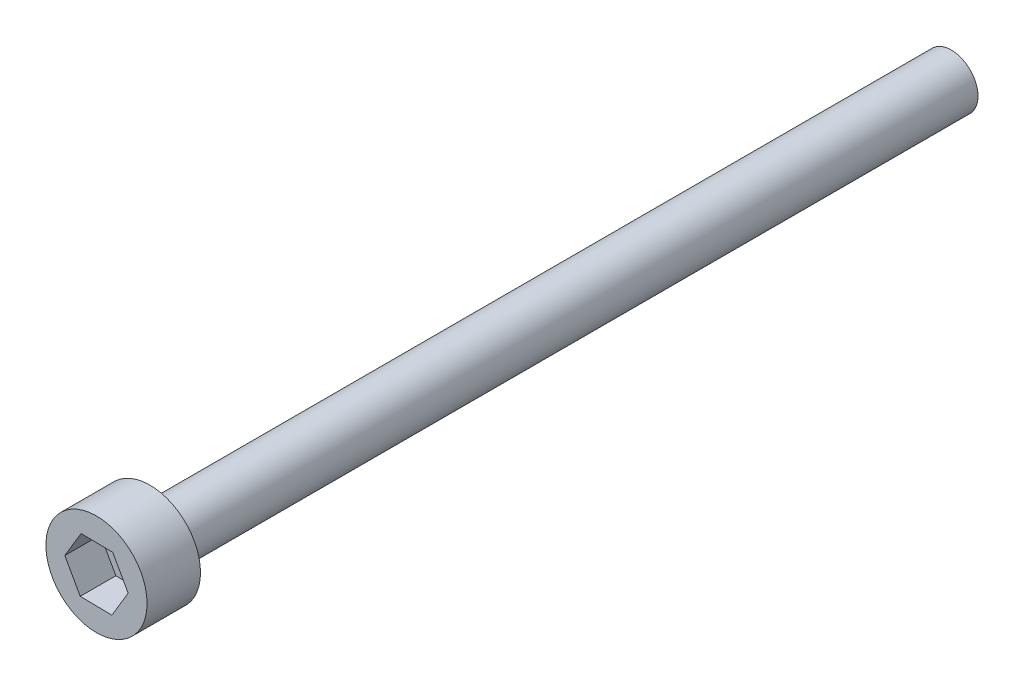
from build123d import *

# Parameters (mm, degrees)
SKETCH_1_R          = 2.84
EXTRUDE_1_DEPTH     = 3
SKETCH_2_R          = 1.5
EXTRUDE_2_DEPTH     = 45
CUT_EXTRUDE_1_DEPTH = 2


with BuildPart() as part:
    # 草图1 → 凸台-拉伸1 (new body)
    with BuildSketch(Plane.XY):
        Circle(SKETCH_1_R)
    extrude(amount=EXTRUDE_1_DEPTH)

    # 草图2 → 凸台-拉伸2 (add)
    with BuildSketch(Plane(origin=(0, 0, 0), x_dir=(-1, 0, 0), z_dir=(0, 0, -1))):
        with Locations(Location((0, 0, 0), (0, 0, 180))):
            Circle(SKETCH_2_R)
    extrude(amount=EXTRUDE_2_DEPTH)

    # 草图3 → 切除-拉伸1 (cut)
    with BuildSketch(Plane.XY.offset(3)):
        Polygon((0.912581429, 1.526213769), (-0.865449181, 1.553425585), (-1.77803061, 0.027211816), (-0.912581429, -1.526213769), (0.865449181, -1.553425585), (1.77803061, -0.027211816), align=None)
    extrude(amount=-CUT_EXTRUDE_1_DEPTH, mode=Mode.SUBTRACT)


solid = part.part
